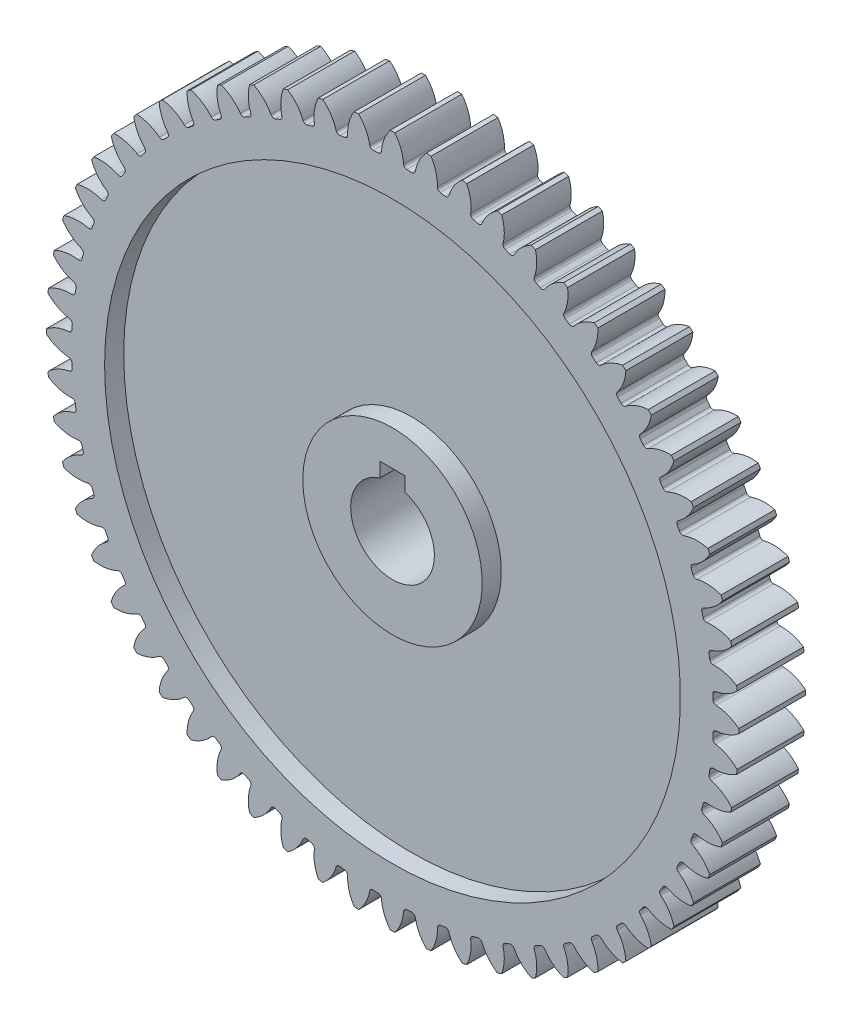
from build123d import *

# Parameters (mm, degrees)
CUT_EXTRUDE1_DEPTH = 49.566534429
CIRPATTERN1_COUNT  = 60
SKETCH5_W          = 2.38125
SKETCH5_H          = 2.38125
CUT_EXTRUDE2_DEPTH = 49.566534429


with BuildPart() as part:
    # Sketch3 → Revolve1 (revolve)
    with BuildSketch(Plane(origin=(0, 0, 0), x_dir=(0, 0, -1), z_dir=(1, 0, 0)), mode=Mode.PRIVATE) as revolve1_sk:
        Polygon((-7.112, 32.83585), (-0.762, 32.83585), (-0.762, 27.305), (-2.576285714, 27.305), (-2.576285714, 8.509), (7.112, 8.509), (7.112, 3.96875), (-7.112, 3.96875), (-7.112, 8.509), (-5.297714286, 8.509), (-5.297714286, 27.305), (-7.112, 27.305), align=None)
    revolve(revolve1_sk.sketch.rotate(Axis((0, 0, -7.112), (0, 0, 1)), 90), axis=Axis((0, 0, -7.112), (0, 0, 1)))

    # Sketch4 → Cut-Extrude1 (cut, symmetric)
    with BuildSketch(Plane.XY.offset(7.112)):
        with BuildLine():
            ThreePointArc((-0.216588191, 32.835135675), (-0.798258229, 31.826398587), (-1.055754581, 30.690799109))
            ThreePointArc((-1.055754581, 30.690799109), (-1.151101354, 30.486277626), (-1.358237494, 30.396752969))
            ThreePointArc((-1.358237494, 30.396752969), (-1.592430502, 30.385384073), (-1.82652895, 30.372210854))
            ThreePointArc((-1.82652895, 30.372210854), (-2.04188825, 30.439593463), (-2.158091021, 30.633028104))
            ThreePointArc((-2.158091021, 30.633028104), (-2.532879248, 31.735490952), (-3.216804575, 32.677900997))
            ThreePointArc((-3.216804575, 32.677900997), (-1.718495609, 32.790849609), (-0.216588191, 32.835135675))
        make_face()
    cut_extrude1 = extrude(amount=CUT_EXTRUDE1_DEPTH, both=True, mode=Mode.SUBTRACT)

    # CirPattern1: Cut-Extrude1 ×60 about axis
    cirpattern1_axis = Axis((0, 0, 0), (0, 0, 1))
    for i in range(1, CIRPATTERN1_COUNT):
        add(cut_extrude1.rotate(cirpattern1_axis, i * 360 / CIRPATTERN1_COUNT), mode=Mode.SUBTRACT)

    # Sketch5 → Cut-Extrude2 (cut, through all)
    with BuildSketch(Plane(origin=(0, 0, -7.112), x_dir=(-1, 0, 0), z_dir=(0, 0, -1))):
        with Locations((0, 3.96875)):
            Rectangle(SKETCH5_W, SKETCH5_H)
    extrude(amount=-CUT_EXTRUDE2_DEPTH, mode=Mode.SUBTRACT)


solid = part.part
